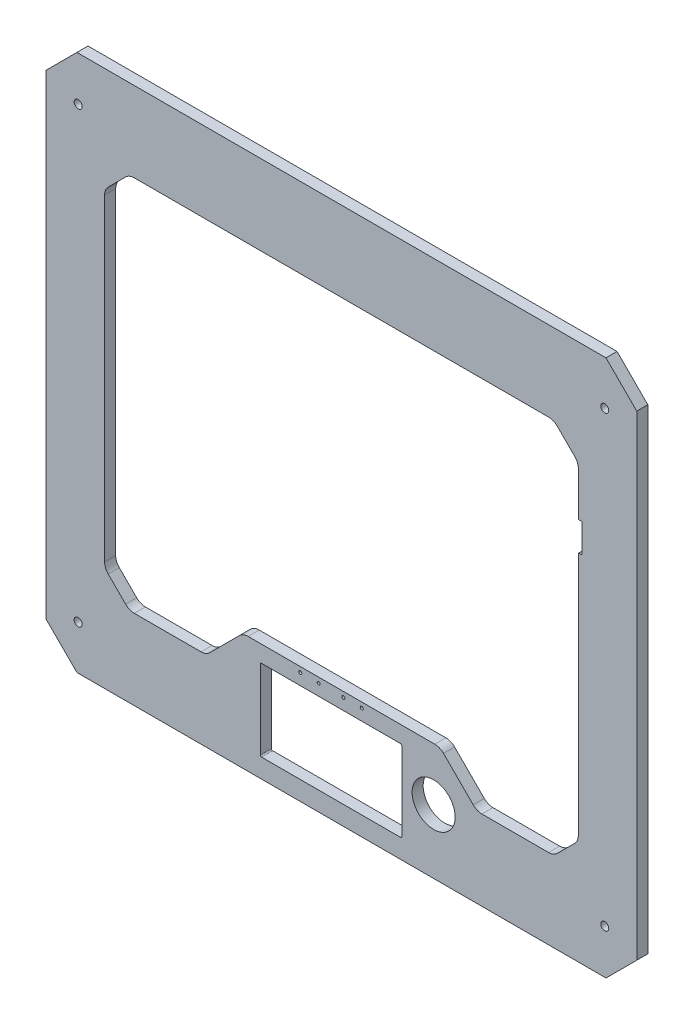
from build123d import *

# Parameters (mm, degrees)
BOSS_EXTRUDE1_DEPTH         = 9
CUT_EXTRUDE1_DEPTH          = 325.521282045
CUT_EXTRUDE2_DEPTH          = 325.521282045
SKETCH6_R                   = 17.5
CUT_EXTRUDE3_DEPTH          = 325.521282045
F_6_5_6_5_DIAMETER_HOLE1_D  = 6.5
CUT_EXTRUDE4_REACH          = 326.521
CUT_EXTRUDE5_REACH          = 326.521
SKETCH8_R                   = 1.25
CUT_EXTRUDE6_REACH          = 326.521
SKETCH9_W                   = 3
SKETCH9_H                   = 23.5
FILLET1_R                   = 0.5
M3_TAPPED_HOLE1_D           = 2.5
M3_TAPPED_HOLE1_DEPTH       = 10
M3_TAPPED_HOLE1_CSINK_D     = 3.05
M3_TAPPED_HOLE1_CSINK_ANGLE = 90
M3_TAPPED_HOLE1_TIP         = 0.751075774


with BuildPart() as part:
    # Sketch1 → Boss-Extrude1 (new body)
    with BuildSketch(Plane.XY):
        Polygon((-240, -193.25), (-215, -218.25), (215, -218.25), (240, -193.25), (240, 193.25), (215, 218.25), (-215, 218.25), (-240, 193.25), align=None)
    extrude(amount=-BOSS_EXTRUDE1_DEPTH)

    # Sketch2 → Cut-Extrude1 (cut, through all)
    with BuildSketch(Plane(origin=(0, 0, -9), x_dir=(-1, 0, 0), z_dir=(0, 0, -1))):
        with BuildLine():
            Line((114.142135624, -153.25), (168.357864376, -153.25))
            ThreePointArc((168.357864376, -153.25), (172.1846987, -152.488795325), (175.428932188, -150.321067812))
            Line((175.428932188, -150.321067812), (189.571067812, -136.178932188))
            ThreePointArc((189.571067812, -136.178932188), (191.738795325, -132.9346987), (192.5, -129.107864376))
            Line((192.5, -129.107864376), (192.5, 129.107864376))
            ThreePointArc((192.5, 129.107864376), (191.738795325, 132.9346987), (189.571067812, 136.178932188))
            Line((189.571067812, 136.178932188), (175.428932188, 150.321067812))
            ThreePointArc((175.428932188, 150.321067812), (172.1846987, 152.488795325), (168.357864376, 153.25))
            Line((168.357864376, 153.25), (-168.357864376, 153.25))
            ThreePointArc((-168.357864376, 153.25), (-172.1846987, 152.488795325), (-175.428932188, 150.321067812))
            Line((-175.428932188, 150.321067812), (-189.571067812, 136.178932188))
            ThreePointArc((-189.571067812, 136.178932188), (-191.738795325, 132.9346987), (-192.5, 129.107864376))
            Line((-192.5, 129.107864376), (-192.5, -129.107864376))
            ThreePointArc((-192.5, -129.107864376), (-191.738795325, -132.9346987), (-189.571067812, -136.178932188))
            Line((-189.571067812, -136.178932188), (-175.428932188, -150.321067812))
            ThreePointArc((-175.428932188, -150.321067812), (-172.1846987, -152.488795325), (-168.357864376, -153.25))
            Line((-168.357864376, -153.25), (-114.142135624, -153.25))
            ThreePointArc((-114.142135624, -153.25), (-110.3153013, -152.488795325), (-107.071067812, -150.321067812))
            Line((-107.071067812, -150.321067812), (-82.928932183, -126.178932183))
            ThreePointArc((-82.928932183, -126.178932183), (-79.684698695, -124.01120467), (-75.857864371, -123.249999995))
            Line((-75.857864371, -123.249999995), (75.857864371, -123.249999995))
            ThreePointArc((75.857864371, -123.249999995), (79.684698695, -124.01120467), (82.928932183, -126.178932183))
            Line((82.928932183, -126.178932183), (107.071067812, -150.321067812))
            ThreePointArc((107.071067812, -150.321067812), (110.3153013, -152.488795325), (114.142135624, -153.25))
        make_face()
    extrude(amount=-CUT_EXTRUDE1_DEPTH, mode=Mode.SUBTRACT)

    # Sketch3 → Cut-Extrude2 (cut, through all)
    with BuildSketch(Plane(origin=(0, 0, -9), x_dir=(-1, 0, 0), z_dir=(0, 0, -1))):
        with BuildLine():
            Line((48, -149.249999995), (-48, -149.249999995))
            ThreePointArc((-48, -149.249999995), (-48.707106781, -149.542893214), (-49, -150.249999995))
            Line((-49, -150.249999995), (-49, -189.249999995))
            ThreePointArc((-49, -189.249999995), (-48.707106781, -189.957106776), (-48, -190.249999995))
            Line((-48, -190.249999995), (48, -190.249999995))
            ThreePointArc((48, -190.249999995), (48.707106781, -189.957106776), (49, -189.249999995))
            Line((49, -189.249999995), (49, -150.249999995))
            ThreePointArc((49, -150.249999995), (48.707106781, -149.542893214), (48, -149.249999995))
        make_face()
    extrude(amount=-CUT_EXTRUDE2_DEPTH, mode=Mode.SUBTRACT)

    # Sketch6 → Cut-Extrude3 (cut, through all)
    with BuildSketch(Plane(origin=(0, 0, -9), x_dir=(-1, 0, 0), z_dir=(0, 0, -1))):
        with Locations(Location((-74.9, -166.249999995, 0), (0, 0, 180))):
            Circle(SKETCH6_R)
    extrude(amount=-CUT_EXTRUDE3_DEPTH, mode=Mode.SUBTRACT)

    # Ø6.5 (6.5) Diameter Hole1 (through all)
    with Locations(Plane.XY):
        with Locations((214, -182.25), (-214, -182.25), (-214, 182.25), (214, 182.25)):
            Hole(F_6_5_6_5_DIAMETER_HOLE1_D / 2)

    # Sketch7 → Cut-Extrude4 (cut, up to next)
    with BuildSketch(Plane(origin=(0, 0, -9), x_dir=(-1, 0, 0), z_dir=(0, 0, -1)), mode=Mode.PRIVATE) as cut_extrude4_sk1:
        with BuildLine():
            Line((-48, -136.75), (65, -136.75))
            ThreePointArc((65, -136.75), (65.707106781, -137.042893219), (66, -137.75))
            Line((66, -137.75), (66, -201.75))
            ThreePointArc((66, -201.75), (65.707106781, -202.457106781), (65, -202.75))
            Line((65, -202.75), (-48, -202.75))
            ThreePointArc((-48, -202.75), (-48.707106781, -202.457106781), (-49, -201.75))
            Line((-49, -201.75), (-49, -137.75))
            ThreePointArc((-49, -137.75), (-48.707106781, -137.042893219), (-48, -136.75))
        make_face()
    cut_extrude4_tool1 = extrude(cut_extrude4_sk1.sketch, amount=-CUT_EXTRUDE4_REACH, mode=Mode.PRIVATE) & part.part
    add(cut_extrude4_tool1.solids().sort_by_distance((-8.5, -169.75, -9))[0], mode=Mode.SUBTRACT)

    # Sketch8 → Cut-Extrude5 (cut, up to next)
    with BuildSketch(Plane.XY, mode=Mode.PRIVATE) as cut_extrude5_sk1:
        with Locations((-33.5, -127.541900756)):
            Circle(SKETCH8_R)
    cut_extrude5_tool1 = extrude(cut_extrude5_sk1.sketch, amount=-CUT_EXTRUDE5_REACH, mode=Mode.PRIVATE) & part.part
    # Sketch8 → Cut-Extrude5 (cut, up to next)
    with BuildSketch(Plane.XY, mode=Mode.PRIVATE) as cut_extrude5_sk2:
        with Locations((-18.5, -127.541900756)):
            Circle(SKETCH8_R)
    cut_extrude5_tool2 = extrude(cut_extrude5_sk2.sketch, amount=-CUT_EXTRUDE5_REACH, mode=Mode.PRIVATE) & part.part
    # Sketch8 → Cut-Extrude5 (cut, up to next)
    with BuildSketch(Plane.XY, mode=Mode.PRIVATE) as cut_extrude5_sk3:
        with Locations((1.5, -127.541900756)):
            Circle(SKETCH8_R)
    cut_extrude5_tool3 = extrude(cut_extrude5_sk3.sketch, amount=-CUT_EXTRUDE5_REACH, mode=Mode.PRIVATE) & part.part
    # Sketch8 → Cut-Extrude5 (cut, up to next)
    with BuildSketch(Plane.XY, mode=Mode.PRIVATE) as cut_extrude5_sk4:
        with Locations((16.5, -127.541900756)):
            Circle(SKETCH8_R)
    cut_extrude5_tool4 = extrude(cut_extrude5_sk4.sketch, amount=-CUT_EXTRUDE5_REACH, mode=Mode.PRIVATE) & part.part
    add(cut_extrude5_tool1.solids().sort_by_distance((-33.5, -127.541901, 0))[0], mode=Mode.SUBTRACT)
    add(cut_extrude5_tool2.solids().sort_by_distance((-18.5, -127.541901, 0))[0], mode=Mode.SUBTRACT)
    add(cut_extrude5_tool3.solids().sort_by_distance((1.5, -127.541901, 0))[0], mode=Mode.SUBTRACT)
    add(cut_extrude5_tool4.solids().sort_by_distance((16.5, -127.541901, 0))[0], mode=Mode.SUBTRACT)

    # Sketch9 → Cut-Extrude6 (cut, up to next)
    with BuildSketch(Plane.XY, mode=Mode.PRIVATE) as cut_extrude6_sk1:
        with Locations((194, 81.5)):
            Rectangle(SKETCH9_W, SKETCH9_H)
    cut_extrude6_tool1 = extrude(cut_extrude6_sk1.sketch, amount=-CUT_EXTRUDE6_REACH, mode=Mode.PRIVATE) & part.part
    add(cut_extrude6_tool1.solids().sort_by_distance((194, 81.5, 0))[0], mode=Mode.SUBTRACT)

    # Fillet1
    fillet1_edges = [part.edges().sort_by_distance(p)[0] for p in [
        (192.5, 69.75, -4.5),
        (192.5, 93.25, -4.5),
        (195.5, 93.25, -4.5),
        (195.5, 69.75, -4.5),
    ]]
    fillet(fillet1_edges, radius=FILLET1_R)

    # M3 Tapped Hole1
    with Locations(Plane.ZY.offset(-195.5)):
        with Locations((-4.5, 88.625), (-4.5, 74.375)):
            CounterSinkHole(M3_TAPPED_HOLE1_D / 2, M3_TAPPED_HOLE1_CSINK_D / 2, depth=M3_TAPPED_HOLE1_DEPTH, counter_sink_angle=M3_TAPPED_HOLE1_CSINK_ANGLE)
            with Locations((0, 0, -(M3_TAPPED_HOLE1_DEPTH + M3_TAPPED_HOLE1_TIP / 2))):  # 118° drill point
                Cone(0, M3_TAPPED_HOLE1_D / 2, M3_TAPPED_HOLE1_TIP, mode=Mode.SUBTRACT)


solid = part.part
